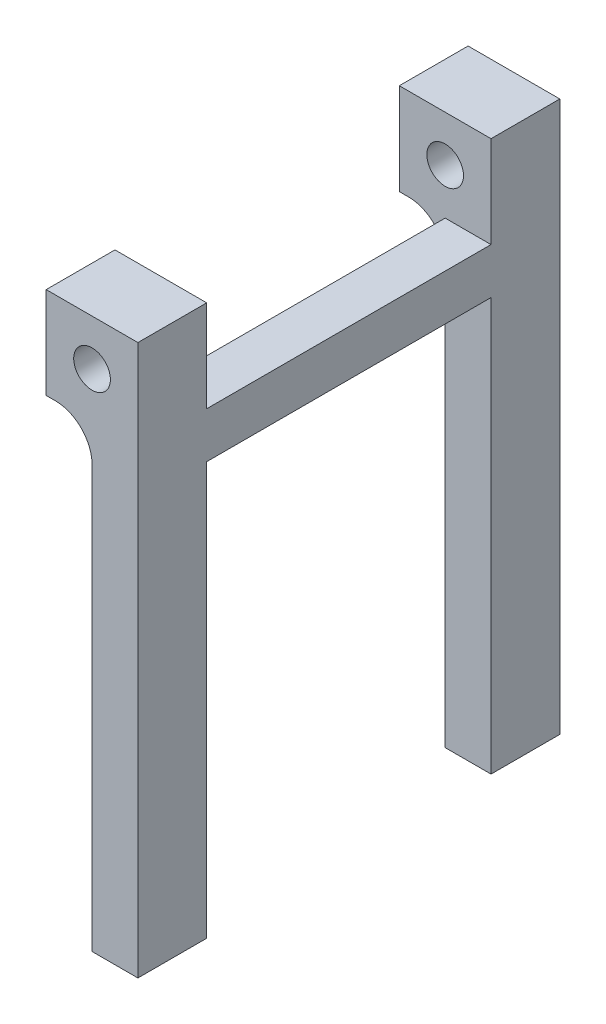
from build123d import *

# Parameters (mm, degrees)
EXTRUDE_2_DEPTH = 5
SKETCH_5_W      = 20
SKETCH_5_H      = 20
SKETCH_5_R      = 4
EXTRUDE_3_DEPTH = 15
FILLET_1_R      = 8


with BuildPart() as part:
    # 草图3 → 凸台-拉伸2 (new, symmetric)
    with BuildSketch(Plane(origin=(0, 0, 0), x_dir=(0, 0, -1), z_dir=(1, 0, 0))):
        Polygon((31, 0), (46, 0), (46, 100), (-46, 100), (-46, 0), (-31, 0), (-31, 90), (31, 90), align=None)
    extrude(amount=EXTRUDE_2_DEPTH, both=True)

    # 草图5 → 凸台-拉伸3 (add)
    with BuildSketch(Plane.XY.offset(46)):
        with Locations((-5, 110)):
            Rectangle(SKETCH_5_W, SKETCH_5_H)
        with Locations((-5, 110)):
            Circle(SKETCH_5_R, mode=Mode.SUBTRACT)
    extrude_3 = extrude(amount=-EXTRUDE_3_DEPTH)

    # 镜向1: 凸台-拉伸3 across plane
    add(extrude_3.mirror(Plane.XY))

    # 圆角1
    fillet_1_edges = [part.edges().sort_by_distance(p)[0] for p in [
        (-5, 100, -38.5),
        (-5, 100, 38.5),
    ]]
    fillet(fillet_1_edges, radius=FILLET_1_R)


solid = part.part
